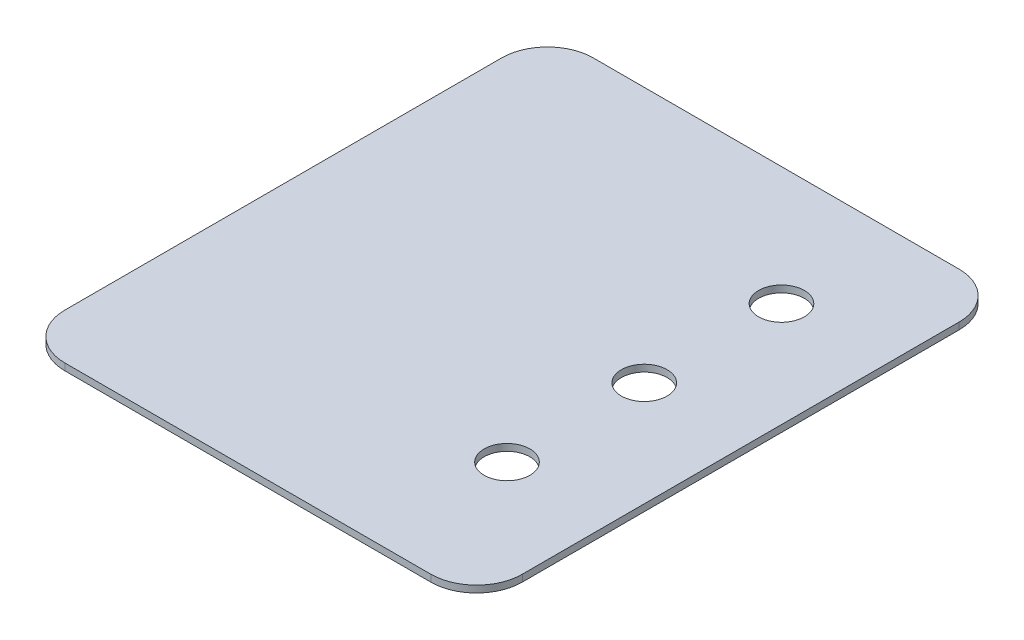
from build123d import *

# Parameters (mm, degrees)
BOSS_EXTRUDE1_DEPTH = 0.6
SKETCH3_R           = 2
CUT_EXTRUDE1_DEPTH  = 10
SKETCH4_R           = 1.15
BOSS_EXTRUDE3_DEPTH = 3


with BuildPart() as part:
    # Sketch2 → Boss-Extrude1 (new body)
    with BuildSketch(Plane(origin=(0, 0, 0), x_dir=(1, 0, 0), z_dir=(0, 1, 0))):
        with BuildLine():
            Line((-16, 23.1), (16, 23.1))
            ThreePointArc((16, 23.1), (18.828427125, 21.928427125), (20, 19.1))
            Line((20, 19.1), (20, -19.1))
            ThreePointArc((20, -19.1), (18.828427125, -21.928427125), (16, -23.1))
            Line((16, -23.1), (-16, -23.1))
            ThreePointArc((-16, -23.1), (-18.828427125, -21.928427125), (-20, -19.1))
            Line((-20, -19.1), (-20, 19.1))
            ThreePointArc((-20, 19.1), (-18.828427125, 21.928427125), (-16, 23.1))
        make_face()
    extrude(amount=BOSS_EXTRUDE1_DEPTH)

    # Sketch3 → Cut-Extrude1 (cut)
    with BuildSketch(Plane(origin=(0, 0.6, 0), x_dir=(1, 0, 0), z_dir=(0, 1, 0))):
        with Locations(Location((10.84244602, -11.278395934, 0), (0, 0, 270))):
            Circle(SKETCH3_R)
        with Locations(Location((10.84244602, 0.721604066, 0), (0, 0, 270))):
            Circle(SKETCH3_R)
        with Locations(Location((10.84244602, 12.721604066, 0), (0, 0, 270))):
            Circle(SKETCH3_R)
    extrude(amount=-CUT_EXTRUDE1_DEPTH, mode=Mode.SUBTRACT)

    # Sketch4 → Boss-Extrude3 (add)
    with BuildSketch(Plane(origin=(0, 0.6, 0), x_dir=(1, 0, 0), z_dir=(0, 1, 0))):
        with Locations(Location((15.8, 17, 0), (0, 0, 270))):
            Circle(SKETCH4_R)
        with Locations(Location((0, 17, 0), (0, 0, 270))):
            Circle(SKETCH4_R)
        with Locations(Location((-15.8, 17, 0), (0, 0, 270))):
            Circle(SKETCH4_R)
        with Locations(Location((0, 0, 0), (0, 0, 270))):
            Circle(SKETCH4_R)
        with Locations(Location((-15.8, 0, 0), (0, 0, 270))):
            Circle(SKETCH4_R)
        with Locations(Location((0, -17, 0), (0, 0, 270))):
            Circle(SKETCH4_R)
        with Locations(Location((-15.8, -17, 0), (0, 0, 270))):
            Circle(SKETCH4_R)
        with Locations(Location((15.8, 0, 0), (0, 0, 270))):
            Circle(SKETCH4_R)
        with Locations(Location((15.8, -17, 0), (0, 0, 270))):
            Circle(SKETCH4_R)
    extrude(amount=-BOSS_EXTRUDE3_DEPTH)


solid = part.part
